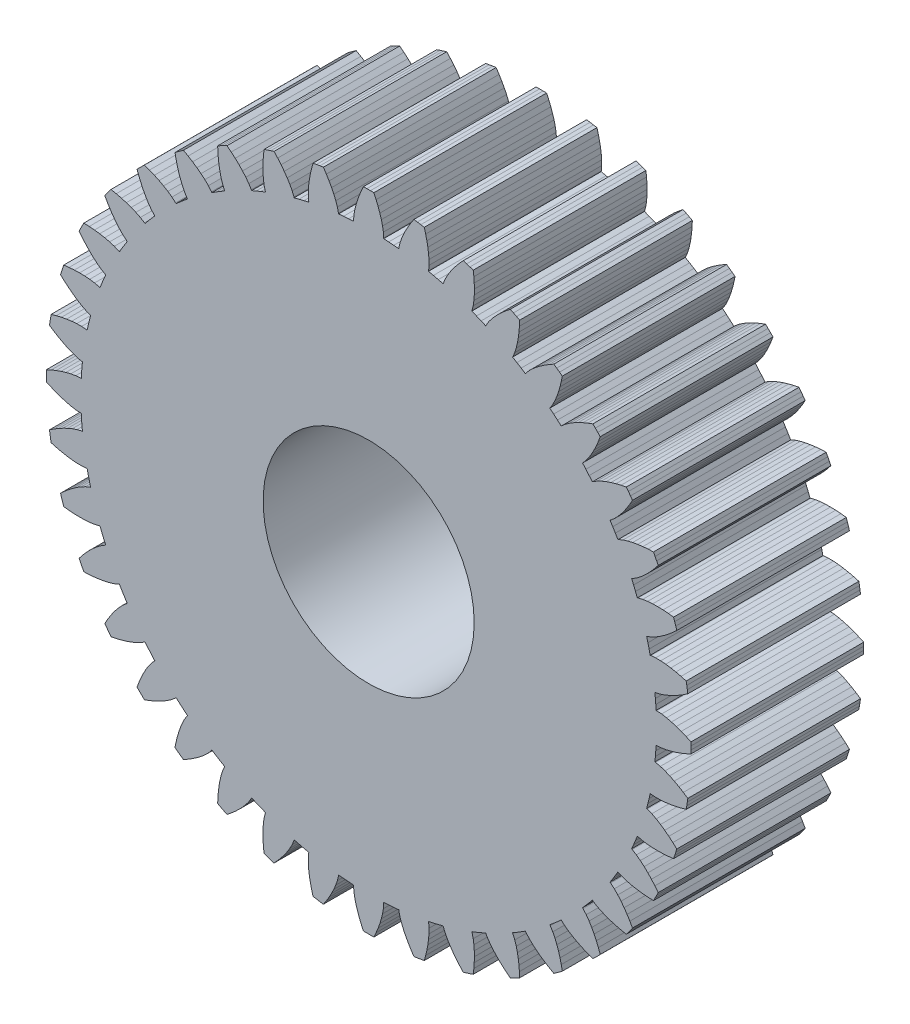
from build123d import *

# Parameters (mm, degrees)
PLANET_TEETH_START = 36
SKETCH_1_R         = 11
PLANET_TEETH_DEPTH = 18


with BuildPart() as part:
    # Эскиз1 → Planet_teeth (new body)
    with BuildSketch(Plane.XY.offset(PLANET_TEETH_START)):
        Polygon((29.958981112, -1.56826361), (30.029049042, -1.571931458), (30.53580677, -1.536242341), (31.044958958, -1.447549874), (31.555239763, -1.32273333), (32.065966664, -1.167486829), (32.576588878, -0.984949332), (33.086612035, -0.777147126), (33.595571456, -0.545507618), (33.59950793, -0.181842974), (33.59950793, 0.181842974), (33.595571456, 0.545507618), (33.086612035, 0.777147126), (32.576588878, 0.984949332), (32.065966664, 1.167486829), (31.555239763, 1.32273333), (31.044958958, 1.447549874), (30.53580677, 1.536242341), (30.029049042, 1.571931458), (29.958981112, 1.56826361), (29.926963764, 2.092089833), (29.885788133, 2.615275832), (29.835466819, 3.137661501), (29.905245875, 3.14499985), (30.400181566, 3.259523948), (30.889190687, 3.426773414), (31.37366348, 3.629878764), (31.853816581, 3.863109212), (32.329597033, 4.123278283), (32.800833531, 4.408307298), (33.267290415, 4.716713735), (33.21428874, 5.076516863), (33.157395724, 5.435725234), (33.09661803, 5.794296762), (32.557688341, 5.943465609), (32.021436989, 6.068924225), (31.488546226, 6.16933547), (30.959821318, 6.24277534), (30.436297307, 6.286229679), (29.919539069, 6.294181245), (29.413437361, 6.250156595), (29.344805861, 6.235572866), (29.231238225, 6.747941302), (29.108725213, 7.258244725), (28.977304315, 7.766326972), (29.045076304, 7.784490823), (29.516003, 7.97502994), (29.972828026, 8.216718168), (30.419563478, 8.493111195), (30.857319818, 8.798582684), (31.286543213, 9.129977102), (31.707389647, 9.485214566), (32.119858276, 9.862793941), (32.01122353, 10.209876008), (31.898838392, 10.555761898), (31.782716027, 10.90041109), (31.227086308, 10.963436243), (30.677811049, 11.003462062), (30.135773276, 11.019274596), (29.602069322, 11.009099501), (29.078193004, 10.970121648), (28.566553018, 10.897136518), (28.073569235, 10.774482135), (28.008064101, 10.749341623), (27.815742589, 11.237636061), (27.614908871, 11.722491545), (27.405624408, 12.203759699), (27.46972056, 12.232301797), (27.905042482, 12.494164227), (28.318434865, 12.80434005), (28.716432867, 13.147215043), (29.101013431, 13.517405849), (29.473110865, 13.911865584), (29.833204598, 14.328564372), (30.181528627, 14.766019428), (30.019935758, 15.09183412), (29.854825792, 15.415880672), (29.686218075, 15.738121121), (29.127569774, 15.713450692), (28.578795586, 15.667058145), (28.040957573, 15.597882612), (27.515416136, 15.504343096), (27.004087084, 15.383892813), (26.510163625, 15.231768124), (26.042436664, 15.033504166), (25.981670849, 14.998425914), (25.715331054, 15.450622925), (25.441121825, 15.898091718), (25.159127075, 16.340695359), (25.217969128, 16.378912904), (25.606967206, 16.705650725), (25.966747854, 17.076676586), (26.306208374, 17.477590822), (26.628143512, 17.90338562), (26.933952712, 18.351197764), (27.224427042, 18.81909737), (27.500029576, 19.305656511), (27.289457536, 19.602181189), (27.0756883, 19.896409302), (26.858746911, 20.188306377), (26.310835803, 20.076547834), (25.776075329, 19.944879261), (25.255680432, 19.792418991), (24.751242086, 19.617818309), (24.265050919, 19.418861481), (23.801006022, 19.191343048), (23.370052872, 18.92235143), (23.315522632, 18.878199183), (22.981722725, 19.283164175), (22.640889925, 19.68222811), (22.293128535, 20.075268868), (22.345267603, 20.122220817), (22.678363413, 20.505788659), (22.975673332, 20.928528669), (23.248237726, 21.377610311), (23.499600327, 21.848524619), (23.731591255, 22.338662552), (23.945293739, 22.846241733), (24.14138853, 23.369924259), (23.887022302, 23.629857502), (23.629857502, 23.887022302), (23.369924259, 24.14138853), (22.846241733, 23.945293739), (22.338662552, 23.731591255), (21.848524619, 23.499600327), (21.377610311, 23.248237726), (20.928528669, 22.975673332), (20.505788659, 22.678363413), (20.122220817, 22.345267603), (20.075268868, 22.293128535), (19.68222811, 22.640889925), (19.283164175, 22.981722725), (18.878199183, 23.315522632), (18.92235143, 23.370052872), (19.191343048, 23.801006022), (19.418861481, 24.265050919), (19.617818309, 24.751242086), (19.792418991, 25.255680432), (19.944879261, 25.776075329), (20.076547834, 26.310835803), (20.188306377, 26.858746911), (19.896409302, 27.0756883), (19.602181189, 27.289457536), (19.305656511, 27.500029576), (18.81909737, 27.224427042), (18.351197764, 26.933952712), (17.90338562, 26.628143512), (17.477590822, 26.306208374), (17.076676586, 25.966747854), (16.705650725, 25.606967206), (16.378912904, 25.217969128), (16.340695359, 25.159127075), (15.898091718, 25.441121825), (15.450622925, 25.715331054), (14.998425914, 25.981670849), (15.033504166, 26.042436664), (15.231768124, 26.510163625), (15.383892813, 27.004087084), (15.504343096, 27.515416136), (15.597882612, 28.040957573), (15.667058145, 28.578795586), (15.713450692, 29.127569774), (15.738121121, 29.686218075), (15.415880672, 29.854825792), (15.09183412, 30.019935758), (14.766019428, 30.181528627), (14.328564372, 29.833204598), (13.911865584, 29.473110865), (13.517405849, 29.101013431), (13.147215043, 28.716432867), (12.80434005, 28.318434865), (12.494164227, 27.905042482), (12.232301797, 27.46972056), (12.203759699, 27.405624408), (11.722491545, 27.614908871), (11.237636061, 27.815742589), (10.749341623, 28.008064101), (10.774482135, 28.073569235), (10.897136518, 28.566553018), (10.970121648, 29.078193004), (11.009099501, 29.602069322), (11.019274596, 30.135773276), (11.003462062, 30.677811049), (10.963436243, 31.227086308), (10.90041109, 31.782716027), (10.555761898, 31.898838392), (10.209876008, 32.01122353), (9.862793941, 32.119858276), (9.485214566, 31.707389647), (9.129977102, 31.286543213), (8.798582684, 30.857319818), (8.493111195, 30.419563478), (8.216718168, 29.972828026), (7.97502994, 29.516003), (7.784490823, 29.045076304), (7.766326972, 28.977304315), (7.258244725, 29.108725213), (6.747941302, 29.231238225), (6.235572866, 29.344805861), (6.250156595, 29.413437361), (6.294181245, 29.919539069), (6.286229679, 30.436297307), (6.24277534, 30.959821318), (6.16933547, 31.488546226), (6.068924225, 32.021436989), (5.943465609, 32.557688341), (5.794296762, 33.09661803), (5.435725234, 33.157395724), (5.076516863, 33.21428874), (4.716713735, 33.267290415), (4.408307298, 32.800833531), (4.123278283, 32.329597033), (3.863109212, 31.853816581), (3.629878764, 31.37366348), (3.426773414, 30.889190687), (3.259523948, 30.400181566), (3.14499985, 29.905245875), (3.137661501, 29.835466819), (2.615275832, 29.885788133), (2.092089833, 29.926963764), (1.56826361, 29.958981112), (1.571931458, 30.029049042), (1.536242341, 30.53580677), (1.447549874, 31.044958958), (1.32273333, 31.555239763), (1.167486829, 32.065966664), (0.984949332, 32.576588878), (0.777147126, 33.086612035), (0.545507618, 33.595571456), (0.181842974, 33.59950793), (-0.181842974, 33.59950793), (-0.545507618, 33.595571456), (-0.777147126, 33.086612035), (-0.984949332, 32.576588878), (-1.167486829, 32.065966664), (-1.32273333, 31.555239763), (-1.447549874, 31.044958958), (-1.536242341, 30.53580677), (-1.571931458, 30.029049042), (-1.56826361, 29.958981112), (-2.092089833, 29.926963764), (-2.615275832, 29.885788133), (-3.137661501, 29.835466819), (-3.14499985, 29.905245875), (-3.259523948, 30.400181566), (-3.426773414, 30.889190687), (-3.629878764, 31.37366348), (-3.863109212, 31.853816581), (-4.123278283, 32.329597033), (-4.408307298, 32.800833531), (-4.716713735, 33.267290415), (-5.076516863, 33.21428874), (-5.435725234, 33.157395724), (-5.794296762, 33.09661803), (-5.943465609, 32.557688341), (-6.068924225, 32.021436989), (-6.16933547, 31.488546226), (-6.24277534, 30.959821318), (-6.286229679, 30.436297307), (-6.294181245, 29.919539069), (-6.250156595, 29.413437361), (-6.235572866, 29.344805861), (-6.747941302, 29.231238225), (-7.258244725, 29.108725213), (-7.766326972, 28.977304315), (-7.784490823, 29.045076304), (-7.97502994, 29.516003), (-8.216718168, 29.972828026), (-8.493111195, 30.419563478), (-8.798582684, 30.857319818), (-9.129977102, 31.286543213), (-9.485214566, 31.707389647), (-9.862793941, 32.119858276), (-10.209876008, 32.01122353), (-10.555761898, 31.898838392), (-10.90041109, 31.782716027), (-10.963436243, 31.227086308), (-11.003462062, 30.677811049), (-11.019274596, 30.135773276), (-11.009099501, 29.602069322), (-10.970121648, 29.078193004), (-10.897136518, 28.566553018), (-10.774482135, 28.073569235), (-10.749341623, 28.008064101), (-11.237636061, 27.815742589), (-11.722491545, 27.614908871), (-12.203759699, 27.405624408), (-12.232301797, 27.46972056), (-12.494164227, 27.905042482), (-12.80434005, 28.318434865), (-13.147215043, 28.716432867), (-13.517405849, 29.101013431), (-13.911865584, 29.473110865), (-14.328564372, 29.833204598), (-14.766019428, 30.181528627), (-15.09183412, 30.019935758), (-15.415880672, 29.854825792), (-15.738121121, 29.686218075), (-15.713450692, 29.127569774), (-15.667058145, 28.578795586), (-15.597882612, 28.040957573), (-15.504343096, 27.515416136), (-15.383892813, 27.004087084), (-15.231768124, 26.510163625), (-15.033504166, 26.042436664), (-14.998425914, 25.981670849), (-15.450622925, 25.715331054), (-15.898091718, 25.441121825), (-16.340695359, 25.159127075), (-16.378912904, 25.217969128), (-16.705650725, 25.606967206), (-17.076676586, 25.966747854), (-17.477590822, 26.306208374), (-17.90338562, 26.628143512), (-18.351197764, 26.933952712), (-18.81909737, 27.224427042), (-19.305656511, 27.500029576), (-19.602181189, 27.289457536), (-19.896409302, 27.0756883), (-20.188306377, 26.858746911), (-20.076547834, 26.310835803), (-19.944879261, 25.776075329), (-19.792418991, 25.255680432), (-19.617818309, 24.751242086), (-19.418861481, 24.265050919), (-19.191343048, 23.801006022), (-18.92235143, 23.370052872), (-18.878199183, 23.315522632), (-19.283164175, 22.981722725), (-19.68222811, 22.640889925), (-20.075268868, 22.293128535), (-20.122220817, 22.345267603), (-20.505788659, 22.678363413), (-20.928528669, 22.975673332), (-21.377610311, 23.248237726), (-21.848524619, 23.499600327), (-22.338662552, 23.731591255), (-22.846241733, 23.945293739), (-23.369924259, 24.14138853), (-23.629857502, 23.887022302), (-23.887022302, 23.629857502), (-24.14138853, 23.369924259), (-23.945293739, 22.846241733), (-23.731591255, 22.338662552), (-23.499600327, 21.848524619), (-23.248237726, 21.377610311), (-22.975673332, 20.928528669), (-22.678363413, 20.505788659), (-22.345267603, 20.122220817), (-22.293128535, 20.075268868), (-22.640889925, 19.68222811), (-22.981722725, 19.283164175), (-23.315522632, 18.878199183), (-23.370052872, 18.92235143), (-23.801006022, 19.191343048), (-24.265050919, 19.418861481), (-24.751242086, 19.617818309), (-25.255680432, 19.792418991), (-25.776075329, 19.944879261), (-26.310835803, 20.076547834), (-26.858746911, 20.188306377), (-27.0756883, 19.896409302), (-27.289457536, 19.602181189), (-27.500029576, 19.305656511), (-27.224427042, 18.81909737), (-26.933952712, 18.351197764), (-26.628143512, 17.90338562), (-26.306208374, 17.477590822), (-25.966747854, 17.076676586), (-25.606967206, 16.705650725), (-25.217969128, 16.378912904), (-25.159127075, 16.340695359), (-25.441121825, 15.898091718), (-25.715331054, 15.450622925), (-25.981670849, 14.998425914), (-26.042436664, 15.033504166), (-26.510163625, 15.231768124), (-27.004087084, 15.383892813), (-27.515416136, 15.504343096), (-28.040957573, 15.597882612), (-28.578795586, 15.667058145), (-29.127569774, 15.713450692), (-29.686218075, 15.738121121), (-29.854825792, 15.415880672), (-30.019935758, 15.09183412), (-30.181528627, 14.766019428), (-29.833204598, 14.328564372), (-29.473110865, 13.911865584), (-29.101013431, 13.517405849), (-28.716432867, 13.147215043), (-28.318434865, 12.80434005), (-27.905042482, 12.494164227), (-27.46972056, 12.232301797), (-27.405624408, 12.203759699), (-27.614908871, 11.722491545), (-27.815742589, 11.237636061), (-28.008064101, 10.749341623), (-28.073569235, 10.774482135), (-28.566553018, 10.897136518), (-29.078193004, 10.970121648), (-29.602069322, 11.009099501), (-30.135773276, 11.019274596), (-30.677811049, 11.003462062), (-31.227086308, 10.963436243), (-31.782716027, 10.90041109), (-31.898838392, 10.555761898), (-32.01122353, 10.209876008), (-32.119858276, 9.862793941), (-31.707389647, 9.485214566), (-31.286543213, 9.129977102), (-30.857319818, 8.798582684), (-30.419563478, 8.493111195), (-29.972828026, 8.216718168), (-29.516003, 7.97502994), (-29.045076304, 7.784490823), (-28.977304315, 7.766326972), (-29.108725213, 7.258244725), (-29.231238225, 6.747941302), (-29.344805861, 6.235572866), (-29.413437361, 6.250156595), (-29.919539069, 6.294181245), (-30.436297307, 6.286229679), (-30.959821318, 6.24277534), (-31.488546226, 6.16933547), (-32.021436989, 6.068924225), (-32.557688341, 5.943465609), (-33.09661803, 5.794296762), (-33.157395724, 5.435725234), (-33.21428874, 5.076516863), (-33.267290415, 4.716713735), (-32.800833531, 4.408307298), (-32.329597033, 4.123278283), (-31.853816581, 3.863109212), (-31.37366348, 3.629878764), (-30.889190687, 3.426773414), (-30.400181566, 3.259523948), (-29.905245875, 3.14499985), (-29.835466819, 3.137661501), (-29.885788133, 2.615275832), (-29.926963764, 2.092089833), (-29.958981112, 1.56826361), (-30.029049042, 1.571931458), (-30.53580677, 1.536242341), (-31.044958958, 1.447549874), (-31.555239763, 1.32273333), (-32.065966664, 1.167486829), (-32.576588878, 0.984949332), (-33.086612035, 0.777147126), (-33.595571456, 0.545507618), (-33.59950793, 0.181842974), (-33.59950793, -0.181842974), (-33.595571456, -0.545507618), (-33.086612035, -0.777147126), (-32.576588878, -0.984949332), (-32.065966664, -1.167486829), (-31.555239763, -1.32273333), (-31.044958958, -1.447549874), (-30.53580677, -1.536242341), (-30.029049042, -1.571931458), (-29.958981112, -1.56826361), (-29.926963764, -2.092089833), (-29.885788133, -2.615275832), (-29.835466819, -3.137661501), (-29.905245875, -3.14499985), (-30.400181566, -3.259523948), (-30.889190687, -3.426773414), (-31.37366348, -3.629878764), (-31.853816581, -3.863109212), (-32.329597033, -4.123278283), (-32.800833531, -4.408307298), (-33.267290415, -4.716713735), (-33.21428874, -5.076516863), (-33.157395724, -5.435725234), (-33.09661803, -5.794296762), (-32.557688341, -5.943465609), (-32.021436989, -6.068924225), (-31.488546226, -6.16933547), (-30.959821318, -6.24277534), (-30.436297307, -6.286229679), (-29.919539069, -6.294181245), (-29.413437361, -6.250156595), (-29.344805861, -6.235572866), (-29.231238225, -6.747941302), (-29.108725213, -7.258244725), (-28.977304315, -7.766326972), (-29.045076304, -7.784490823), (-29.516003, -7.97502994), (-29.972828026, -8.216718168), (-30.419563478, -8.493111195), (-30.857319818, -8.798582684), (-31.286543213, -9.129977102), (-31.707389647, -9.485214566), (-32.119858276, -9.862793941), (-32.01122353, -10.209876008), (-31.898838392, -10.555761898), (-31.782716027, -10.90041109), (-31.227086308, -10.963436243), (-30.677811049, -11.003462062), (-30.135773276, -11.019274596), (-29.602069322, -11.009099501), (-29.078193004, -10.970121648), (-28.566553018, -10.897136518), (-28.073569235, -10.774482135), (-28.008064101, -10.749341623), (-27.815742589, -11.237636061), (-27.614908871, -11.722491545), (-27.405624408, -12.203759699), (-27.46972056, -12.232301797), (-27.905042482, -12.494164227), (-28.318434865, -12.80434005), (-28.716432867, -13.147215043), (-29.101013431, -13.517405849), (-29.473110865, -13.911865584), (-29.833204598, -14.328564372), (-30.181528627, -14.766019428), (-30.019935758, -15.09183412), (-29.854825792, -15.415880672), (-29.686218075, -15.738121121), (-29.127569774, -15.713450692), (-28.578795586, -15.667058145), (-28.040957573, -15.597882612), (-27.515416136, -15.504343096), (-27.004087084, -15.383892813), (-26.510163625, -15.231768124), (-26.042436664, -15.033504166), (-25.981670849, -14.998425914), (-25.715331054, -15.450622925), (-25.441121825, -15.898091718), (-25.159127075, -16.340695359), (-25.217969128, -16.378912904), (-25.606967206, -16.705650725), (-25.966747854, -17.076676586), (-26.306208374, -17.477590822), (-26.628143512, -17.90338562), (-26.933952712, -18.351197764), (-27.224427042, -18.81909737), (-27.500029576, -19.305656511), (-27.289457536, -19.602181189), (-27.0756883, -19.896409302), (-26.858746911, -20.188306377), (-26.310835803, -20.076547834), (-25.776075329, -19.944879261), (-25.255680432, -19.792418991), (-24.751242086, -19.617818309), (-24.265050919, -19.418861481), (-23.801006022, -19.191343048), (-23.370052872, -18.92235143), (-23.315522632, -18.878199183), (-22.981722725, -19.283164175), (-22.640889925, -19.68222811), (-22.293128535, -20.075268868), (-22.345267603, -20.122220817), (-22.678363413, -20.505788659), (-22.975673332, -20.928528669), (-23.248237726, -21.377610311), (-23.499600327, -21.848524619), (-23.731591255, -22.338662552), (-23.945293739, -22.846241733), (-24.14138853, -23.369924259), (-23.887022302, -23.629857502), (-23.629857502, -23.887022302), (-23.369924259, -24.14138853), (-22.846241733, -23.945293739), (-22.338662552, -23.731591255), (-21.848524619, -23.499600327), (-21.377610311, -23.248237726), (-20.928528669, -22.975673332), (-20.505788659, -22.678363413), (-20.122220817, -22.345267603), (-20.075268868, -22.293128535), (-19.68222811, -22.640889925), (-19.283164175, -22.981722725), (-18.878199183, -23.315522632), (-18.92235143, -23.370052872), (-19.191343048, -23.801006022), (-19.418861481, -24.265050919), (-19.617818309, -24.751242086), (-19.792418991, -25.255680432), (-19.944879261, -25.776075329), (-20.076547834, -26.310835803), (-20.188306377, -26.858746911), (-19.896409302, -27.0756883), (-19.602181189, -27.289457536), (-19.305656511, -27.500029576), (-18.81909737, -27.224427042), (-18.351197764, -26.933952712), (-17.90338562, -26.628143512), (-17.477590822, -26.306208374), (-17.076676586, -25.966747854), (-16.705650725, -25.606967206), (-16.378912904, -25.217969128), (-16.340695359, -25.159127075), (-15.898091718, -25.441121825), (-15.450622925, -25.715331054), (-14.998425914, -25.981670849), (-15.033504166, -26.042436664), (-15.231768124, -26.510163625), (-15.383892813, -27.004087084), (-15.504343096, -27.515416136), (-15.597882612, -28.040957573), (-15.667058145, -28.578795586), (-15.713450692, -29.127569774), (-15.738121121, -29.686218075), (-15.415880672, -29.854825792), (-15.09183412, -30.019935758), (-14.766019428, -30.181528627), (-14.328564372, -29.833204598), (-13.911865584, -29.473110865), (-13.517405849, -29.101013431), (-13.147215043, -28.716432867), (-12.80434005, -28.318434865), (-12.494164227, -27.905042482), (-12.232301797, -27.46972056), (-12.203759699, -27.405624408), (-11.722491545, -27.614908871), (-11.237636061, -27.815742589), (-10.749341623, -28.008064101), (-10.774482135, -28.073569235), (-10.897136518, -28.566553018), (-10.970121648, -29.078193004), (-11.009099501, -29.602069322), (-11.019274596, -30.135773276), (-11.003462062, -30.677811049), (-10.963436243, -31.227086308), (-10.90041109, -31.782716027), (-10.555761898, -31.898838392), (-10.209876008, -32.01122353), (-9.862793941, -32.119858276), (-9.485214566, -31.707389647), (-9.129977102, -31.286543213), (-8.798582684, -30.857319818), (-8.493111195, -30.419563478), (-8.216718168, -29.972828026), (-7.97502994, -29.516003), (-7.784490823, -29.045076304), (-7.766326972, -28.977304315), (-7.258244725, -29.108725213), (-6.747941302, -29.231238225), (-6.235572866, -29.344805861), (-6.250156595, -29.413437361), (-6.294181245, -29.919539069), (-6.286229679, -30.436297307), (-6.24277534, -30.959821318), (-6.16933547, -31.488546226), (-6.068924225, -32.021436989), (-5.943465609, -32.557688341), (-5.794296762, -33.09661803), (-5.435725234, -33.157395724), (-5.076516863, -33.21428874), (-4.716713735, -33.267290415), (-4.408307298, -32.800833531), (-4.123278283, -32.329597033), (-3.863109212, -31.853816581), (-3.629878764, -31.37366348), (-3.426773414, -30.889190687), (-3.259523948, -30.400181566), (-3.14499985, -29.905245875), (-3.137661501, -29.835466819), (-2.615275832, -29.885788133), (-2.092089833, -29.926963764), (-1.56826361, -29.958981112), (-1.571931458, -30.029049042), (-1.536242341, -30.53580677), (-1.447549874, -31.044958958), (-1.32273333, -31.555239763), (-1.167486829, -32.065966664), (-0.984949332, -32.576588878), (-0.777147126, -33.086612035), (-0.545507618, -33.595571456), (-0.181842974, -33.59950793), (0.181842974, -33.59950793), (0.545507618, -33.595571456), (0.777147126, -33.086612035), (0.984949332, -32.576588878), (1.167486829, -32.065966664), (1.32273333, -31.555239763), (1.447549874, -31.044958958), (1.536242341, -30.53580677), (1.571931458, -30.029049042), (1.56826361, -29.958981112), (2.092089833, -29.926963764), (2.615275832, -29.885788133), (3.137661501, -29.835466819), (3.14499985, -29.905245875), (3.259523948, -30.400181566), (3.426773414, -30.889190687), (3.629878764, -31.37366348), (3.863109212, -31.853816581), (4.123278283, -32.329597033), (4.408307298, -32.800833531), (4.716713735, -33.267290415), (5.076516863, -33.21428874), (5.435725234, -33.157395724), (5.794296762, -33.09661803), (5.943465609, -32.557688341), (6.068924225, -32.021436989), (6.16933547, -31.488546226), (6.24277534, -30.959821318), (6.286229679, -30.436297307), (6.294181245, -29.919539069), (6.250156595, -29.413437361), (6.235572866, -29.344805861), (6.747941302, -29.231238225), (7.258244725, -29.108725213), (7.766326972, -28.977304315), (7.784490823, -29.045076304), (7.97502994, -29.516003), (8.216718168, -29.972828026), (8.493111195, -30.419563478), (8.798582684, -30.857319818), (9.129977102, -31.286543213), (9.485214566, -31.707389647), (9.862793941, -32.119858276), (10.209876008, -32.01122353), (10.555761898, -31.898838392), (10.90041109, -31.782716027), (10.963436243, -31.227086308), (11.003462062, -30.677811049), (11.019274596, -30.135773276), (11.009099501, -29.602069322), (10.970121648, -29.078193004), (10.897136518, -28.566553018), (10.774482135, -28.073569235), (10.749341623, -28.008064101), (11.237636061, -27.815742589), (11.722491545, -27.614908871), (12.203759699, -27.405624408), (12.232301797, -27.46972056), (12.494164227, -27.905042482), (12.80434005, -28.318434865), (13.147215043, -28.716432867), (13.517405849, -29.101013431), (13.911865584, -29.473110865), (14.328564372, -29.833204598), (14.766019428, -30.181528627), (15.09183412, -30.019935758), (15.415880672, -29.854825792), (15.738121121, -29.686218075), (15.713450692, -29.127569774), (15.667058145, -28.578795586), (15.597882612, -28.040957573), (15.504343096, -27.515416136), (15.383892813, -27.004087084), (15.231768124, -26.510163625), (15.033504166, -26.042436664), (14.998425914, -25.981670849), (15.450622925, -25.715331054), (15.898091718, -25.441121825), (16.340695359, -25.159127075), (16.378912904, -25.217969128), (16.705650725, -25.606967206), (17.076676586, -25.966747854), (17.477590822, -26.306208374), (17.90338562, -26.628143512), (18.351197764, -26.933952712), (18.81909737, -27.224427042), (19.305656511, -27.500029576), (19.602181189, -27.289457536), (19.896409302, -27.0756883), (20.188306377, -26.858746911), (20.076547834, -26.310835803), (19.944879261, -25.776075329), (19.792418991, -25.255680432), (19.617818309, -24.751242086), (19.418861481, -24.265050919), (19.191343048, -23.801006022), (18.92235143, -23.370052872), (18.878199183, -23.315522632), (19.283164175, -22.981722725), (19.68222811, -22.640889925), (20.075268868, -22.293128535), (20.122220817, -22.345267603), (20.505788659, -22.678363413), (20.928528669, -22.975673332), (21.377610311, -23.248237726), (21.848524619, -23.499600327), (22.338662552, -23.731591255), (22.846241733, -23.945293739), (23.369924259, -24.14138853), (23.629857502, -23.887022302), (23.887022302, -23.629857502), (24.14138853, -23.369924259), (23.945293739, -22.846241733), (23.731591255, -22.338662552), (23.499600327, -21.848524619), (23.248237726, -21.377610311), (22.975673332, -20.928528669), (22.678363413, -20.505788659), (22.345267603, -20.122220817), (22.293128535, -20.075268868), (22.640889925, -19.68222811), (22.981722725, -19.283164175), (23.315522632, -18.878199183), (23.370052872, -18.92235143), (23.801006022, -19.191343048), (24.265050919, -19.418861481), (24.751242086, -19.617818309), (25.255680432, -19.792418991), (25.776075329, -19.944879261), (26.310835803, -20.076547834), (26.858746911, -20.188306377), (27.0756883, -19.896409302), (27.289457536, -19.602181189), (27.500029576, -19.305656511), (27.224427042, -18.81909737), (26.933952712, -18.351197764), (26.628143512, -17.90338562), (26.306208374, -17.477590822), (25.966747854, -17.076676586), (25.606967206, -16.705650725), (25.217969128, -16.378912904), (25.159127075, -16.340695359), (25.441121825, -15.898091718), (25.715331054, -15.450622925), (25.981670849, -14.998425914), (26.042436664, -15.033504166), (26.510163625, -15.231768124), (27.004087084, -15.383892813), (27.515416136, -15.504343096), (28.040957573, -15.597882612), (28.578795586, -15.667058145), (29.127569774, -15.713450692), (29.686218075, -15.738121121), (29.854825792, -15.415880672), (30.019935758, -15.09183412), (30.181528627, -14.766019428), (29.833204598, -14.328564372), (29.473110865, -13.911865584), (29.101013431, -13.517405849), (28.716432867, -13.147215043), (28.318434865, -12.80434005), (27.905042482, -12.494164227), (27.46972056, -12.232301797), (27.405624408, -12.203759699), (27.614908871, -11.722491545), (27.815742589, -11.237636061), (28.008064101, -10.749341623), (28.073569235, -10.774482135), (28.566553018, -10.897136518), (29.078193004, -10.970121648), (29.602069322, -11.009099501), (30.135773276, -11.019274596), (30.677811049, -11.003462062), (31.227086308, -10.963436243), (31.782716027, -10.90041109), (31.898838392, -10.555761898), (32.01122353, -10.209876008), (32.119858276, -9.862793941), (31.707389647, -9.485214566), (31.286543213, -9.129977102), (30.857319818, -8.798582684), (30.419563478, -8.493111195), (29.972828026, -8.216718168), (29.516003, -7.97502994), (29.045076304, -7.784490823), (28.977304315, -7.766326972), (29.108725213, -7.258244725), (29.231238225, -6.747941302), (29.344805861, -6.235572866), (29.413437361, -6.250156595), (29.919539069, -6.294181245), (30.436297307, -6.286229679), (30.959821318, -6.24277534), (31.488546226, -6.16933547), (32.021436989, -6.068924225), (32.557688341, -5.943465609), (33.09661803, -5.794296762), (33.157395724, -5.435725234), (33.21428874, -5.076516863), (33.267290415, -4.716713735), (32.800833531, -4.408307298), (32.329597033, -4.123278283), (31.853816581, -3.863109212), (31.37366348, -3.629878764), (30.889190687, -3.426773414), (30.400181566, -3.259523948), (29.905245875, -3.14499985), (29.835466819, -3.137661501), (29.885788133, -2.615275832), (29.926963764, -2.092089833), align=None)
        Circle(SKETCH_1_R, mode=Mode.SUBTRACT)
    extrude(amount=PLANET_TEETH_DEPTH)


solid = part.part
